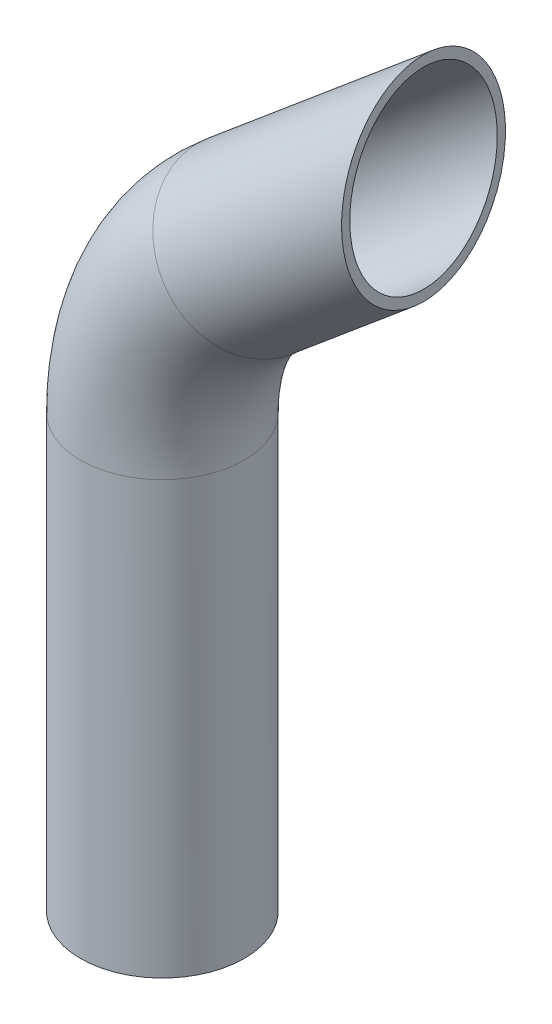
from build123d import *

# Parameters (mm, degrees)
SKETCH2_R          = 30
SKETCH2_R_2        = 27
CUT_EXTRUDE1_DEPTH = 40


with BuildPart() as part:
    # Sweep-Thin1: sweep along a path in Sketch1
    with BuildLine(Plane.XY) as sweep_thin1_path:
        Line((0, -144.479334258), (0, 13.552976508))
        ThreePointArc((0, 13.552976508), (8.432299167, 51.588620065), (32.149115128, 82.496976389))
        Line((32.149115128, 82.496976389), (114.906666468, 151.938807195))
    # Sketch2 → Sweep-Thin1 (sweep)
    with BuildSketch(Plane(origin=(114.906666468, 151.938807195, 0), x_dir=(0, 0, 1), z_dir=(-0.7660444431189792, -0.6427876096865379, 0))):
        Circle(SKETCH2_R)
        Circle(SKETCH2_R_2, mode=Mode.SUBTRACT)
    sweep(path=sweep_thin1_path.line)

    # Sketch4 → Cut-Extrude1 (cut, symmetric)
    with BuildSketch(Plane.XY):
        Polygon((95.623038177, 174.920140489), (95.623038177, 96.595703129), (134.190294758, 128.957473901), align=None)
    extrude(amount=CUT_EXTRUDE1_DEPTH, both=True, mode=Mode.SUBTRACT)


solid = part.part
